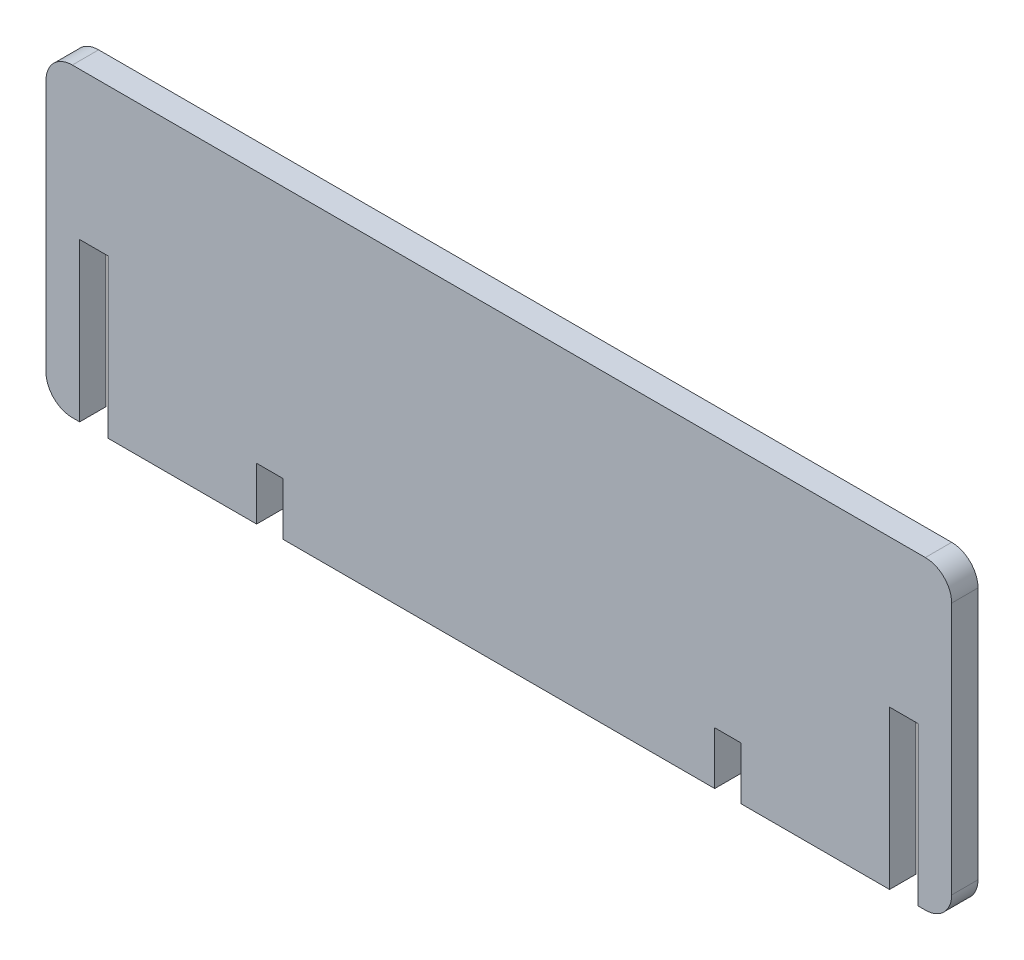
from build123d import *

# Parameters (mm, degrees)
RESSALTO_EXTRUS_O1_DEPTH = 2.5


with BuildPart() as part:
    # Esboço1 → Ressalto-extrusão1 (new body)
    with BuildSketch(Plane.XY):
        with BuildLine():
            Line((53.368768098, -72.405467359), (-27.631231902, -72.405467359))
            ThreePointArc((-27.631231902, -72.405467359), (-29.398998855, -73.137700406), (-30.131231902, -74.905467359))
            Line((-30.131231902, -74.905467359), (-30.131231902, -98.905467359))
            ThreePointArc((-30.131231902, -98.905467359), (-29.398998855, -100.673234312), (-27.631231902, -101.405467359))
            Line((-27.631231902, -101.405467359), (-26.934280418, -101.405467359))
            Line((-26.934280418, -101.405467359), (-26.934280418, -86.405467359))
            Line((-26.934280418, -86.405467359), (-24.231231902, -86.405467359))
            Line((-24.231231902, -86.405467359), (-24.231231902, -101.405467359))
            Line((-24.231231902, -101.405467359), (-10.131231902, -101.405467359))
            Line((-10.131231902, -101.405467359), (-10.131231902, -96.405467359))
            Line((-10.131231902, -96.405467359), (-7.631231902, -96.405467359))
            Line((-7.631231902, -96.405467359), (-7.631231902, -101.405467359))
            Line((-7.631231902, -101.405467359), (33.368768098, -101.405467359))
            Line((33.368768098, -101.405467359), (33.368768098, -96.405467359))
            Line((33.368768098, -96.405467359), (35.868768098, -96.405467359))
            Line((35.868768098, -96.405467359), (35.868768098, -101.405467359))
            Line((35.868768098, -101.405467359), (49.968768098, -101.405467359))
            Line((49.968768098, -101.405467359), (49.968768098, -86.405467359))
            Line((49.968768098, -86.405467359), (52.671816614, -86.405467359))
            Line((52.671816614, -86.405467359), (52.671816614, -101.405467359))
            Line((52.671816614, -101.405467359), (53.368768098, -101.405467359))
            ThreePointArc((53.368768098, -101.405467359), (55.136535051, -100.673234312), (55.868768098, -98.905467359))
            Line((55.868768098, -98.905467359), (55.868768098, -74.905467359))
            ThreePointArc((55.868768098, -74.905467359), (55.136535051, -73.137700406), (53.368768098, -72.405467359))
        make_face()
    extrude(amount=RESSALTO_EXTRUS_O1_DEPTH)


solid = part.part
